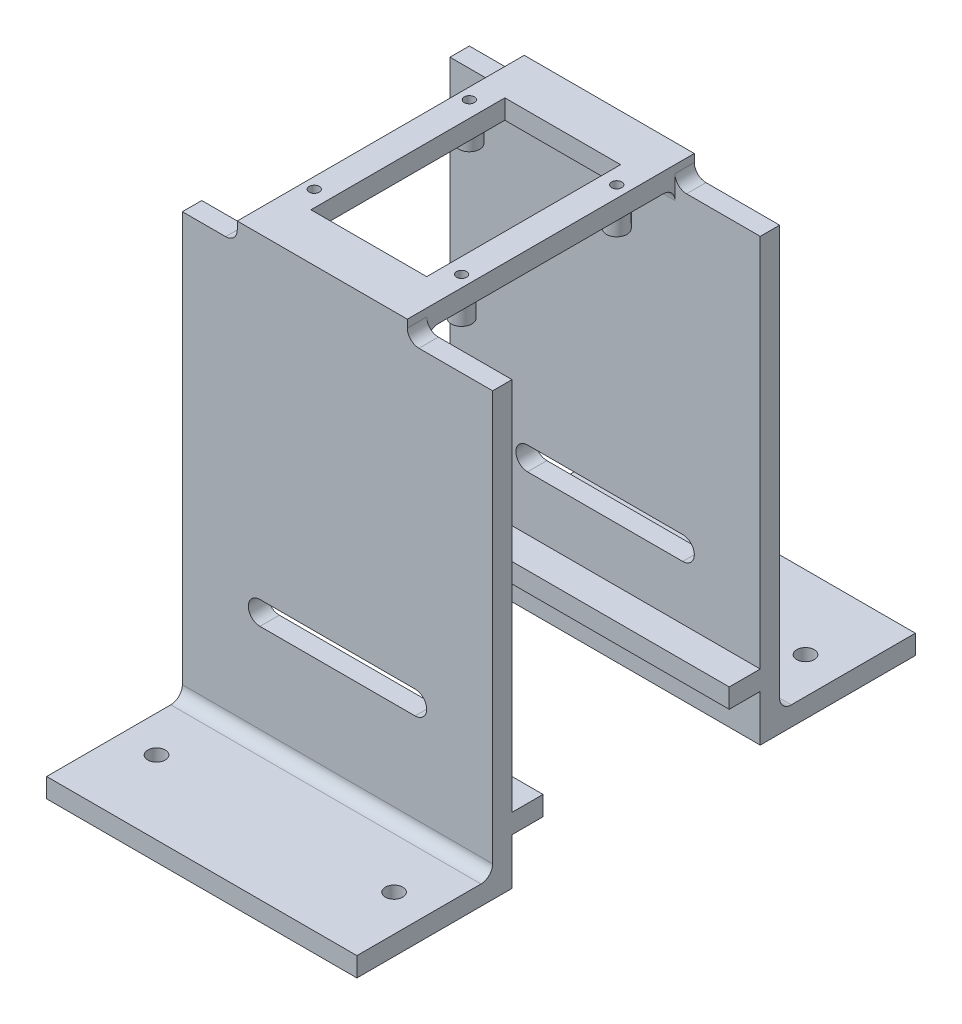
from build123d import *

# Parameters (mm, degrees)
SKETCH1_W             = 80
SKETCH1_H             = 40
SKETCH1_R             = 2.25
BOSS_EXTRUDE1_DEPTH   = 5
BOSS_EXTRUDE1_2_DEPTH = 5
SKETCH2_W             = 80
SKETCH2_H             = 5
BOSS_EXTRUDE2_DEPTH   = 108.62
SKETCH3_W             = 43.85
SKETCH3_H             = 74
BOSS_EXTRUDE3_DEPTH   = 5
SKETCH5_W             = 29.85
SKETCH5_H             = 50
CUT_EXTRUDE2_DEPTH    = 10
CUT_EXTRUDE1_REACH    = 146.412
SKETCH4_R             = 1.3
FILLET1_R             = 3
FILLET2_R             = 3
SKETCH9_R             = 2.65
SKETCH9_R_2           = 1.05
BOSS_EXTRUDE5_DEPTH   = 4.75
SKETCH10_W            = 12
SKETCH10_H            = 6.8
CUT_EXTRUDE4_DEPTH    = 8
SKETCH11_W            = 80
SKETCH11_H            = 5
BOSS_EXTRUDE6_DEPTH   = 8
CUT_EXTRUDE5_REACH    = 167.987


with BuildPart() as part:
    # Sketch1 → Boss-Extrude1 (new body)
    with BuildSketch(Plane(origin=(0, 0, 0), x_dir=(1, 0, 0), z_dir=(0, 1, 0))):
        with Locations((0, 52)):
            Rectangle(SKETCH1_W, SKETCH1_H)
        with Locations(Location((-30.625, 53.044055982, 0), (0, 0, 270))):
            Circle(SKETCH1_R, mode=Mode.SUBTRACT)
        with Locations(Location((30.625, 53.044055982, 0), (0, 0, 90))):
            Circle(SKETCH1_R, mode=Mode.SUBTRACT)
    extrude(amount=BOSS_EXTRUDE1_DEPTH)



with BuildPart() as body_2:
    # Sketch1 → Boss-Extrude1 2 (new body)
    with BuildSketch(Plane(origin=(0, 0, 0), x_dir=(1, 0, 0), z_dir=(0, 1, 0))):
        with Locations((0, -52)):
            Rectangle(SKETCH1_W, SKETCH1_H)
        with Locations(Location((30.625, -53.044055982, 0), (0, 0, 270))):
            Circle(SKETCH1_R, mode=Mode.SUBTRACT)
        with Locations(Location((-30.625, -53.044055982, 0), (0, 0, 90))):
            Circle(SKETCH1_R, mode=Mode.SUBTRACT)
    extrude(amount=BOSS_EXTRUDE1_2_DEPTH)


with BuildPart() as part_1:
    add(part.part)

    add(body_2.part)  # Boss-Extrude2 merges body 2
    # Sketch2 → Boss-Extrude2 (add)
    with BuildSketch(Plane(origin=(0, 5, 0), x_dir=(1, 0, 0), z_dir=(0, 1, 0))):
        with Locations((0, 34.5)):
            Rectangle(SKETCH2_W, SKETCH2_H)
        with Locations((0, -34.5)):
            Rectangle(SKETCH2_W, SKETCH2_H)
    extrude(amount=BOSS_EXTRUDE2_DEPTH)

    # Sketch3 → Boss-Extrude3 (add)
    with BuildSketch(Plane(origin=(0, 113.62, 0), x_dir=(1, 0, 0), z_dir=(0, 1, 0))):
        with Locations((-3.925, 0)):
            Rectangle(SKETCH3_W, SKETCH3_H)
    extrude(amount=BOSS_EXTRUDE3_DEPTH)

    # Sketch5 → Cut-Extrude2 (cut)
    with BuildSketch(Plane.XZ.offset(-113.62)):
        with Locations((-3.925, 0)):
            Rectangle(SKETCH5_W, SKETCH5_H)
    extrude(amount=-CUT_EXTRUDE2_DEPTH, mode=Mode.SUBTRACT)

    # Sketch4 → Cut-Extrude1 (cut, up to next)
    with BuildSketch(Plane(origin=(0, 118.62, 0), x_dir=(1, 0, 0), z_dir=(0, 1, 0)), mode=Mode.PRIVATE) as cut_extrude1_sk1:
        with Locations(Location((-23, 20, 0), (0, 0, 270))):
            Circle(SKETCH4_R)
    cut_extrude1_tool1 = extrude(cut_extrude1_sk1.sketch, amount=-CUT_EXTRUDE1_REACH, mode=Mode.PRIVATE) & part_1.part
    # Sketch4 → Cut-Extrude1 (cut, up to next)
    with BuildSketch(Plane(origin=(0, 118.62, 0), x_dir=(1, 0, 0), z_dir=(0, 1, 0)), mode=Mode.PRIVATE) as cut_extrude1_sk2:
        with Locations(Location((15, 20, 0), (0, 0, 270))):
            Circle(SKETCH4_R)
    cut_extrude1_tool2 = extrude(cut_extrude1_sk2.sketch, amount=-CUT_EXTRUDE1_REACH, mode=Mode.PRIVATE) & part_1.part
    # Sketch4 → Cut-Extrude1 (cut, up to next)
    with BuildSketch(Plane(origin=(0, 118.62, 0), x_dir=(1, 0, 0), z_dir=(0, 1, 0)), mode=Mode.PRIVATE) as cut_extrude1_sk3:
        with Locations(Location((15, -20, 0), (0, 0, 270))):
            Circle(SKETCH4_R)
    cut_extrude1_tool3 = extrude(cut_extrude1_sk3.sketch, amount=-CUT_EXTRUDE1_REACH, mode=Mode.PRIVATE) & part_1.part
    # Sketch4 → Cut-Extrude1 (cut, up to next)
    with BuildSketch(Plane(origin=(0, 118.62, 0), x_dir=(1, 0, 0), z_dir=(0, 1, 0)), mode=Mode.PRIVATE) as cut_extrude1_sk4:
        with Locations(Location((-23, -20, 0), (0, 0, 270))):
            Circle(SKETCH4_R)
    cut_extrude1_tool4 = extrude(cut_extrude1_sk4.sketch, amount=-CUT_EXTRUDE1_REACH, mode=Mode.PRIVATE) & part_1.part
    add(cut_extrude1_tool1.solids().sort_by_distance((-23, 118.62, -20))[0], mode=Mode.SUBTRACT)
    add(cut_extrude1_tool2.solids().sort_by_distance((15, 118.62, -20))[0], mode=Mode.SUBTRACT)
    add(cut_extrude1_tool3.solids().sort_by_distance((15, 118.62, 20))[0], mode=Mode.SUBTRACT)
    add(cut_extrude1_tool4.solids().sort_by_distance((-23, 118.62, 20))[0], mode=Mode.SUBTRACT)

    # Fillet1
    fillet1_edges = [part_1.edges().sort_by_distance(p)[0] for p in [
        (0, 5, -37),
        (-3.925, 113.62, -32),
        (-3.925, 113.62, 32),
        (0, 5, 37),
    ]]
    fillet(fillet1_edges, radius=FILLET1_R)

    # Fillet2
    fillet2_edges = [part_1.edges().sort_by_distance(p)[0] for p in [
        (18, 113.62, -34.5),
        (-25.85, 113.62, -34.5),
        (-25.85, 113.62, 34.5),
        (18, 113.62, 34.5),
    ]]
    fillet(fillet2_edges, radius=FILLET2_R)

    # Sketch9 → Boss-Extrude5 (add)
    # profile 1 of 4: a face of its own
    with BuildSketch(Plane.XZ.offset(-113.62)):
        with Locations(Location((-23, 20, 0), (0, 0, 270))):
            Circle(SKETCH9_R)
        with Locations(Location((-23, 20, 0), (0, 0, 270))):
            Circle(SKETCH9_R_2, mode=Mode.SUBTRACT)
    # profile 2 of 4: a face of its own
    with BuildSketch(Plane.XZ.offset(-113.62)):
        with Locations(Location((-23, -20, 0), (0, 0, 270))):
            Circle(SKETCH9_R)
        with Locations(Location((-23, -20, 0), (0, 0, 270))):
            Circle(SKETCH9_R_2, mode=Mode.SUBTRACT)
    # profile 3 of 4: a face of its own
    with BuildSketch(Plane.XZ.offset(-113.62)):
        with Locations(Location((15, 20, 0), (0, 0, 270))):
            Circle(SKETCH9_R)
        with Locations(Location((15, 20, 0), (0, 0, 270))):
            Circle(SKETCH9_R_2, mode=Mode.SUBTRACT)
    # profile 4 of 4: a face of its own
    with BuildSketch(Plane.XZ.offset(-113.62)):
        with Locations(Location((15, -20, 0), (0, 0, 270))):
            Circle(SKETCH9_R)
        with Locations(Location((15, -20, 0), (0, 0, 270))):
            Circle(SKETCH9_R_2, mode=Mode.SUBTRACT)
    extrude(amount=BOSS_EXTRUDE5_DEPTH)

    # Sketch10 → Cut-Extrude4 (cut)
    with BuildSketch(Plane.XY.offset(37)):
        with Locations((6.7, 110.77)):
            Rectangle(SKETCH10_W, SKETCH10_H)
    extrude(amount=-CUT_EXTRUDE4_DEPTH, mode=Mode.SUBTRACT)

    # Sketch11 → Boss-Extrude6 (add)
    with BuildSketch(Plane(origin=(0, 0, 32), x_dir=(-1, 0, 0), z_dir=(0, 0, -1))):
        with Locations((0, 14.5)):
            Rectangle(SKETCH11_W, SKETCH11_H)
    extrude(amount=BOSS_EXTRUDE6_DEPTH)

    # Mirror3: part across plane


with BuildPart() as part_2:
    add(part_1.part)
    add(part_1.part.mirror(Plane.XY))

    # Sketch12 → Cut-Extrude5 (cut, up to next)
    with BuildSketch(Plane(origin=(0, 0, -37), x_dir=(-1, 0, 0), z_dir=(0, 0, -1)), mode=Mode.PRIVATE) as cut_extrude5_sk1:
        with BuildLine():
            Line((20, 31.025), (-20, 31.025))
            ThreePointArc((-20, 31.025), (-23, 34.025), (-20, 37.025))
            Line((-20, 37.025), (20, 37.025))
            ThreePointArc((20, 37.025), (23, 34.025), (20, 31.025))
        make_face()
    cut_extrude5_tool1 = extrude(cut_extrude5_sk1.sketch, amount=-CUT_EXTRUDE5_REACH, mode=Mode.PRIVATE) & part_2.part
    cut_extrude5 = cut_extrude5_tool1.solids().sort_by_distance((0, 34.025, -37))[0]
    add(cut_extrude5, mode=Mode.SUBTRACT)

    # Mirror4: Cut-Extrude5 across plane
    add(cut_extrude5.mirror(Plane.XY), mode=Mode.SUBTRACT)


solid = part_2.part
